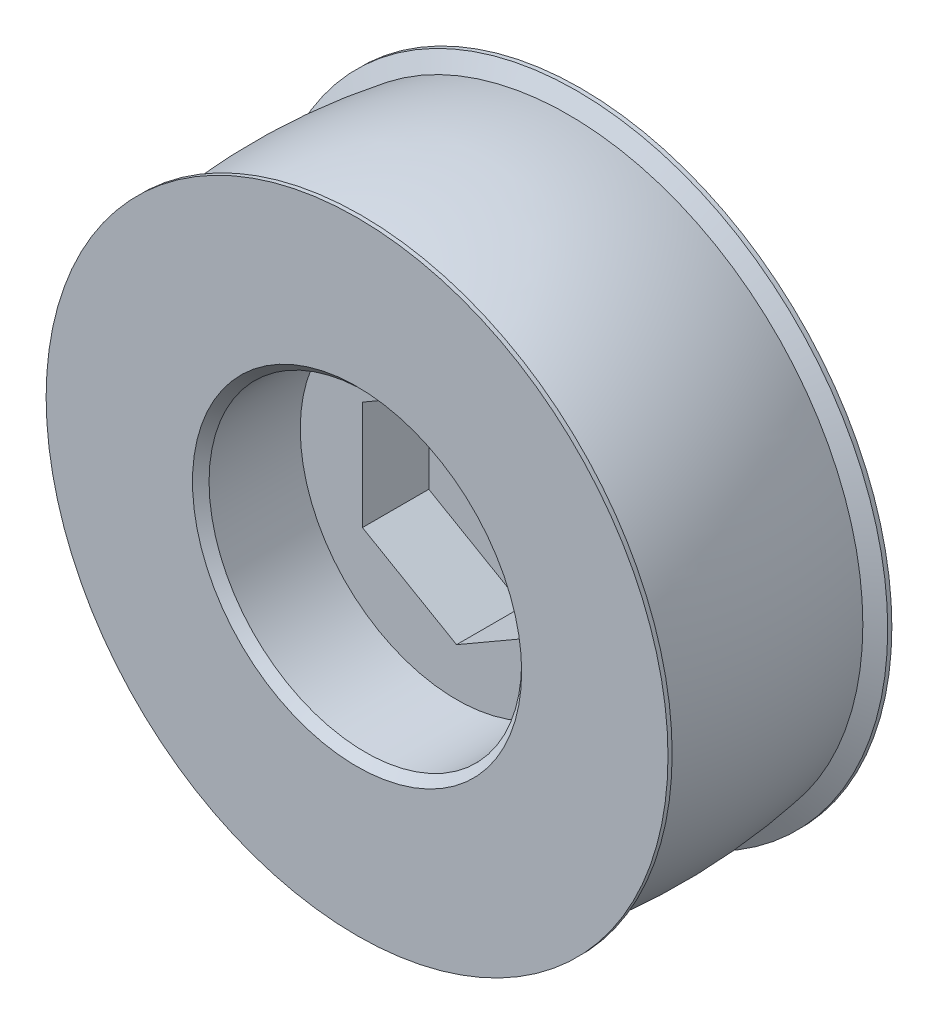
from build123d import *

# Parameters (mm, degrees)
ESQUISSE1_R              = 37.5
ESQUISSE1_R_2            = 3.25
BOSS_EXTRU_1_DEPTH       = 15
ESQUISSE2_R              = 37.5
ESQUISSE2_R_2            = 18.85
BOSS_EXTRU_2_DEPTH       = 12
ENL_V_MAT_EXTRU_9_DEPTH  = 8
CHANFREIN1_SIZE          = 1
ESQUISSE11_R             = 1.25
ENL_V_MAT_EXTRU_10_DEPTH = 60.510503275
ESQUISSE12_R             = 4.25
ENL_V_MAT_EXTRU_11_DEPTH = 4


with BuildPart() as part:
    # Esquisse1 → Boss.-Extru.1 (new body)
    with BuildSketch(Plane.XY):
        Circle(ESQUISSE1_R)
        Circle(ESQUISSE1_R_2, mode=Mode.SUBTRACT)
    extrude(amount=BOSS_EXTRU_1_DEPTH)

    # Esquisse2 → Boss.-Extru.2 (add)
    with BuildSketch(Plane.XY.offset(15)):
        Circle(ESQUISSE2_R)
        Circle(ESQUISSE2_R_2, mode=Mode.SUBTRACT)
    extrude(amount=BOSS_EXTRU_2_DEPTH)

    # Esquisse9 → Enlèv. mat.-Extru.9 (cut)
    with BuildSketch(Plane.XY.offset(15)):
        Polygon((11.35, -6.552925555), (11.35, 6.552925555), (0, 13.105851111), (-11.35, 6.552925555), (-11.35, -6.552925555), (0, -13.105851111), align=None)
    extrude(amount=-ENL_V_MAT_EXTRU_9_DEPTH, mode=Mode.SUBTRACT)

    # Chanfrein1
    chanfrein1_edges = [part.edges().sort_by_distance(p)[0] for p in [
        (-18.85, 0, 27),
    ]]
    chamfer(chanfrein1_edges, length=CHANFREIN1_SIZE)

    # Esquisse10 → Enlèvement de matière-Révolution1 (revolve, cut)
    with BuildSketch(Plane(origin=(0, 0, 0), x_dir=(0, 0, -1), z_dir=(1, 0, 0)), mode=Mode.PRIVATE) as enl_vement_de_mati_re_r_volution1_sk:
        with BuildLine():
            Line((-26.5, 37.5), (-0.5, 37.5))
            Line((-0.5, 37.5), (-1.5, 35.5))
            ThreePointArc((-1.5, 35.5), (-13.5, 36.5), (-25.5, 35.5))
            Line((-25.5, 35.5), (-26.5, 37.5))
        make_face()
    revolve(enl_vement_de_mati_re_r_volution1_sk.sketch.rotate(Axis((0, 0, 0), (0, 0, 1)), 90), axis=Axis((0, 0, 0), (0, 0, 1)), mode=Mode.SUBTRACT)

    # Esquisse11 → Enlèv. mat.-Extru.10 (cut, through all)
    with BuildSketch(Plane(origin=(0, 0, 0), x_dir=(-1, 0, 0), z_dir=(0, 0, -1))):
        with Locations((-6.92820323, 4)):
            Circle(ESQUISSE11_R)
        with Locations((6.92820323, 4)):
            Circle(ESQUISSE11_R)
        with Locations((0, -8)):
            Circle(ESQUISSE11_R)
    extrude(amount=-ENL_V_MAT_EXTRU_10_DEPTH, mode=Mode.SUBTRACT)

    # Esquisse12 → Enlèv. mat.-Extru.11 (cut)
    with BuildSketch(Plane(origin=(0, 0, 0), x_dir=(-1, 0, 0), z_dir=(0, 0, -1))):
        with Locations((-6.92820323, 4)):
            Circle(ESQUISSE12_R)
        with Locations((6.92820323, 4)):
            Circle(ESQUISSE12_R)
        with Locations((0, -8)):
            Circle(ESQUISSE12_R)
    extrude(amount=-ENL_V_MAT_EXTRU_11_DEPTH, mode=Mode.SUBTRACT)


solid = part.part
